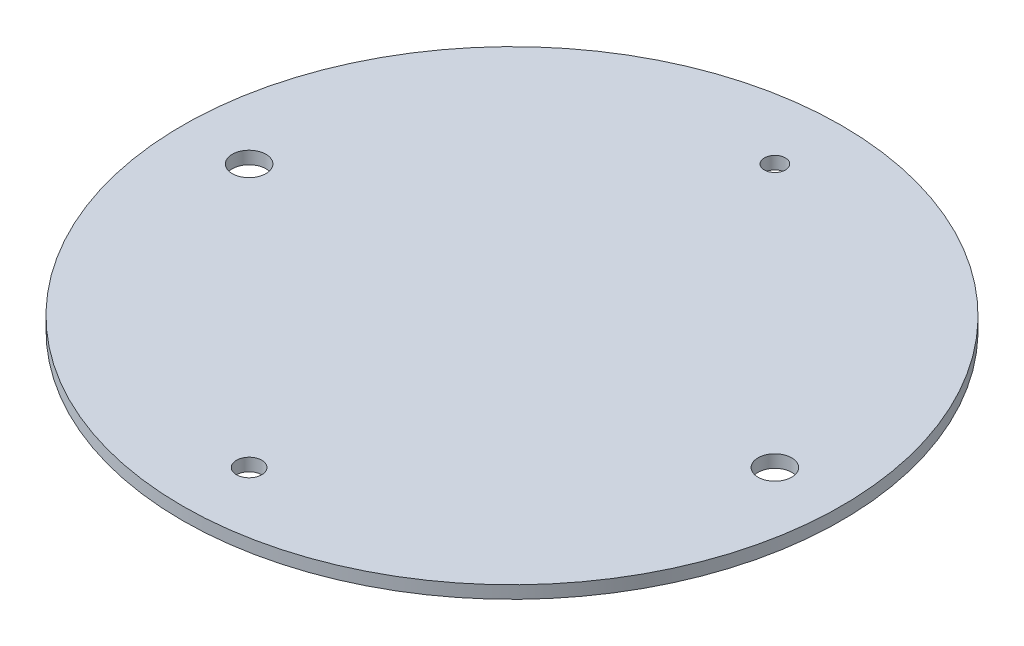
from build123d import *

# Parameters (mm, degrees)
SKETCH1_R           = 78.35
SKETCH1_R_2         = 4
SKETCH1_R_3         = 3
SKETCH1_R_4         = 2.5
BOSS_EXTRUDE1_DEPTH = 3


with BuildPart() as part:
    # Sketch1 → Boss-Extrude1 (new body)
    with BuildSketch(Plane(origin=(0, 0, 0), x_dir=(1, 0, 0), z_dir=(0, 1, 0))):
        with Locations(Location((0, 0, 0), (0, 0, 270))):
            Circle(SKETCH1_R)
        with Locations(Location((-62.5, 0, 0), (0, 0, 270))):
            Circle(SKETCH1_R_2, mode=Mode.SUBTRACT)
        with Locations(Location((0, -62.5, 0), (0, 0, 270))):
            Circle(SKETCH1_R_3, mode=Mode.SUBTRACT)
        with Locations(Location((0, 62.5, 0), (0, 0, 270))):
            Circle(SKETCH1_R_4, mode=Mode.SUBTRACT)
        with Locations(Location((62.5, 0, 0), (0, 0, 270))):
            Circle(SKETCH1_R_2, mode=Mode.SUBTRACT)
    extrude(amount=BOSS_EXTRUDE1_DEPTH)


solid = part.part
